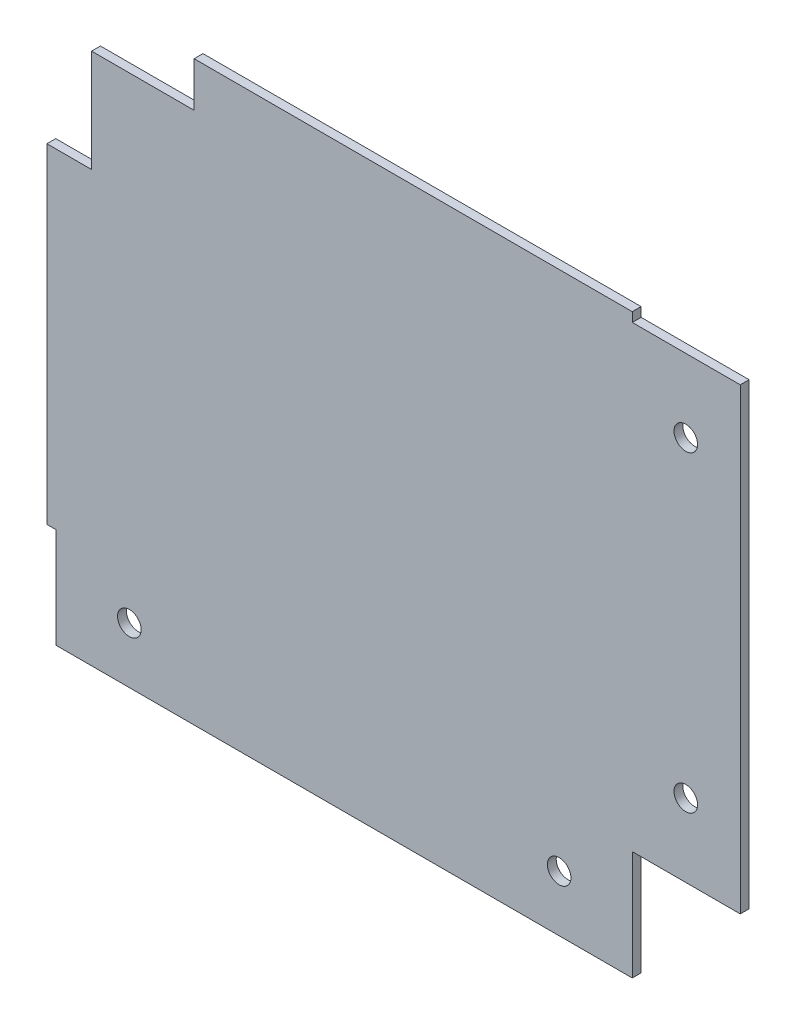
from build123d import *

# Parameters (mm, degrees)
SKETCH1_R           = 4
BOSS_EXTRUDE1_DEPTH = 3


with BuildPart() as part:
    # Sketch1 → Boss-Extrude1 (new body)
    with BuildSketch(Plane.XY):
        Polygon((195.645, 0), (195.645, 37.18), (232.325, 37.18), (232.325, 192.825), (195.645, 192.825), (195.645, 196), (46.835, 196), (46.835, 180.82), (12.005, 180.82), (12.005, 145.99), (-3.175, 145.99), (-3.175, 34.005), (0, 34.005), (0, 0), align=None)
        with Locations((170.815, 19.005)):
            Circle(SKETCH1_R, mode=Mode.SUBTRACT)
        with Locations((24.83, 19.005)):
            Circle(SKETCH1_R, mode=Mode.SUBTRACT)
        with Locations((213.82, 62.01)):
            Circle(SKETCH1_R, mode=Mode.SUBTRACT)
        with Locations((213.82, 167.995)):
            Circle(SKETCH1_R, mode=Mode.SUBTRACT)
    extrude(amount=BOSS_EXTRUDE1_DEPTH)


solid = part.part
